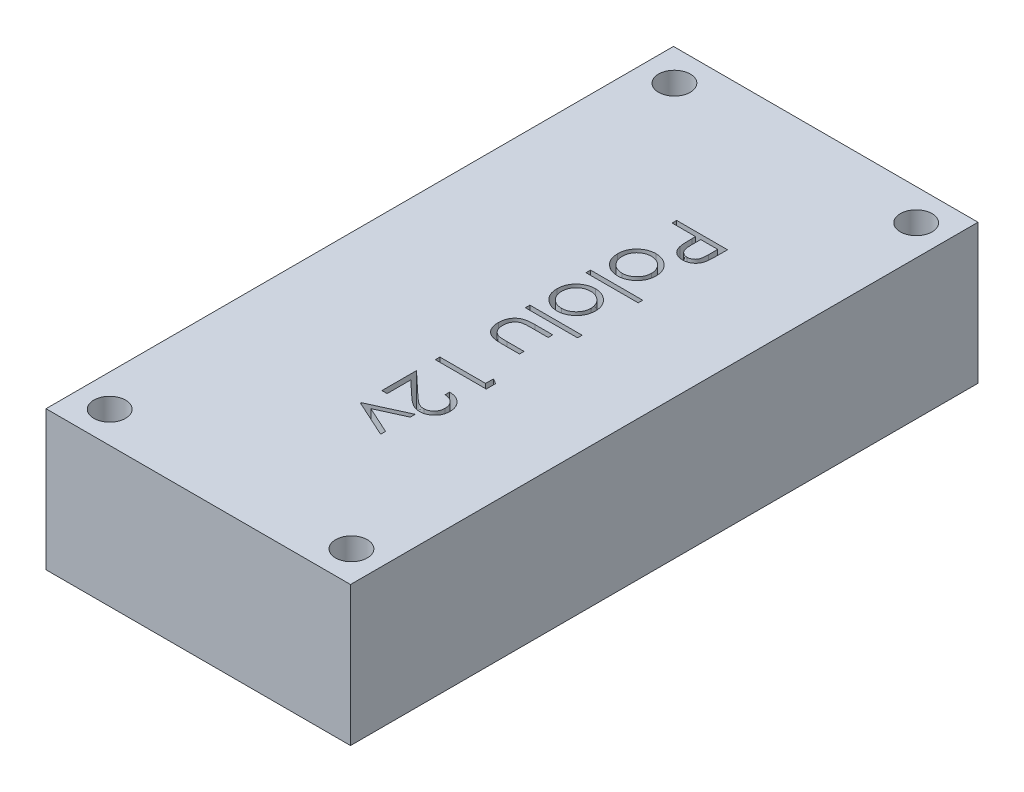
from build123d import *

# Parameters (mm, degrees)
SKETCH1_W           = 20.955
SKETCH1_H           = 43.18
BOSS_EXTRUDE1_DEPTH = 9.6
SKETCH2_R           = 1.0922
CUT_EXTRUDE1_DEPTH  = 26.846974799
SKETCH3_W           = 3.58974359
SKETCH3_H           = 0.314102564
CUT_EXTRUDE2_DEPTH  = 2.54


with BuildPart() as part:
    # Sketch1 → Boss-Extrude1 (new body)
    with BuildSketch(Plane(origin=(0, 0, 0), x_dir=(1, 0, 0), z_dir=(0, 1, 0))):
        Rectangle(SKETCH1_W, SKETCH1_H)
    extrude(amount=BOSS_EXTRUDE1_DEPTH)

    # Sketch2 → Cut-Extrude1 (cut, through all)
    with BuildSketch(Plane(origin=(0, 9.6, 0), x_dir=(1, 0, 0), z_dir=(0, 1, 0))):
        with Locations(Location((-8.255, 19.431, 0), (0, 0, 270))):
            Circle(SKETCH2_R)
        with Locations(Location((8.382, 19.431, 0), (0, 0, 270))):
            Circle(SKETCH2_R)
        with Locations(Location((8.382, -19.431, 0), (0, 0, 270))):
            Circle(SKETCH2_R)
        with Locations(Location((-8.255, -19.431, 0), (0, 0, 270))):
            Circle(SKETCH2_R)
    extrude(amount=-CUT_EXTRUDE1_DEPTH, mode=Mode.SUBTRACT)

    # Sketch3 → Cut-Extrude2 (cut)
    # profile 1 of 9: a face of its own
    with BuildSketch(Plane(origin=(0, 9.6, 0), x_dir=(1, 0, 0), z_dir=(0, 1, 0))):
        with BuildLine():
            Line((3.5, 11.330128205), (3.5, 10.643729968))
            add(Edge.make_bspline(
                [(3.5, 10.643729968), (3.499948104, 10.596519062), (3.499848668, 10.506060869), (3.496833922, 10.376345813), (3.49280723, 10.258536082), (3.487225337, 10.152885701), (3.480628747, 10.059069603), (3.471376708, 9.977512303), (3.461716412, 9.907572747), (3.451895005, 9.865666297), (3.447415865, 9.846554487)],
                knots=[0, 0, 0, 0, 1.415646017, 2.712440637, 3.8905458, 4.950247383, 5.884950622, 6.709939814, 7.411656543, 8, 8, 8, 8], degree=3))
            add(Edge.make_bspline(
                [(3.447415865, 9.846554487), (3.440793975, 9.822360896), (3.42770623, 9.774543806), (3.401491651, 9.705643589), (3.370412659, 9.640086676), (3.334976989, 9.577666458), (3.293734792, 9.519082451), (3.247990678, 9.46358474), (3.197769812, 9.410855007), (3.142098627, 9.362684464), (3.083029703, 9.318337296), (3.019247543, 9.280294152), (2.952140341, 9.248114675), (2.881020836, 9.221833844), (2.806321276, 9.201850274), (2.727823588, 9.187085782), (2.645797497, 9.177639276), (2.589736435, 9.176739893), (2.561197917, 9.176282051)],
                knots=[0, 0, 0, 0, 0.999487232, 1.975422798, 2.933948774, 3.889618007, 4.832992075, 5.786114792, 6.754729845, 7.731954186, 8.717668599, 9.695514499, 10.68728626, 11.680675814, 12.71351902, 13.766008651, 14.862761406, 16, 16, 16, 16], degree=3))
            add(Edge.make_bspline(
                [(2.561197917, 9.176282051), (2.53242014, 9.176703476), (2.476114476, 9.177528022), (2.393741688, 9.187424307), (2.315023298, 9.200754499), (2.240133847, 9.221251551), (2.169518077, 9.248097224), (2.102096845, 9.279589277), (2.039017173, 9.317572808), (1.980050055, 9.361217637), (1.925140143, 9.409769232), (1.874685348, 9.46302217), (1.82898101, 9.520761462), (1.787924666, 9.58280361), (1.752468387, 9.649753459), (1.720711082, 9.720595613), (1.694040021, 9.795945829), (1.68000996, 9.848088343), (1.672876603, 9.874599359)],
                knots=[0, 0, 0, 0, 1.121902311, 2.195077645, 3.232258892, 4.234102512, 5.217864754, 6.176164875, 7.132989551, 8.084763148, 9.034132444, 9.988522005, 10.94243251, 11.903244335, 12.886203696, 13.894208494, 14.929344452, 16, 16, 16, 16], degree=3))
            add(Edge.make_bspline(
                [(1.672876603, 9.874599359), (1.668213621, 9.896526693), (1.657994427, 9.94458172), (1.64658597, 10.023724443), (1.63684837, 10.115869828), (1.629547232, 10.220892108), (1.623296864, 10.338697013), (1.61832877, 10.469348271), (1.615598916, 10.613102348), (1.615458123, 10.713373592), (1.615384615, 10.76572516)],
                knots=[0, 0, 0, 0, 0.601384939, 1.31797006, 2.144135048, 3.087295005, 4.142315834, 5.309527816, 6.595305764, 8, 8, 8, 8], degree=3))
            Line((1.615384615, 10.76572516), (1.615384615, 11.016025641))
            Line((1.615384615, 11.016025641), (0, 11.016025641))
            Line((0, 11.016025641), (0, 11.330128205))
            Line((0, 11.330128205), (3.5, 11.330128205))
        make_face()
        with BuildLine():
            Line((3.141025641, 11.016025641), (1.974358974, 11.016025641))
            Line((1.974358974, 11.016025641), (1.966646635, 10.403245192))
            add(Edge.make_bspline(
                [(1.966646635, 10.403245192), (1.966627924, 10.373324974), (1.966591804, 10.315564609), (1.970631709, 10.231899279), (1.975087995, 10.154476281), (1.982066731, 10.083127479), (1.99126187, 10.018398126), (2.001270604, 9.959456793), (2.014830447, 9.907166353), (2.033737491, 9.845891531), (2.065355346, 9.777844435), (2.112432024, 9.704307904), (2.170792088, 9.640977962), (2.237310672, 9.586541122), (2.311578922, 9.544352716), (2.390418136, 9.512621655), (2.473877922, 9.494138495), (2.530961719, 9.491644415), (2.559795673, 9.490384615)],
                knots=[0, 0, 0, 0, 1.160368111, 2.240066715, 3.248291599, 4.168343349, 5.019594299, 5.784185847, 6.485545725, 7.113397927, 8.269509094, 9.383373363, 10.487084095, 11.595623793, 12.704274681, 13.786671823, 14.88201193, 16, 16, 16, 16], degree=3))
            add(Edge.make_bspline(
                [(2.559795673, 9.490384615), (2.587932, 9.491651143), (2.643863535, 9.494168842), (2.725874557, 9.512767449), (2.803877317, 9.544290774), (2.877231232, 9.586826997), (2.943477588, 9.639700782), (3.000520555, 9.701627273), (3.047000556, 9.771341973), (3.076793746, 9.836225159), (3.095014888, 9.89382123), (3.107758306, 9.94385443), (3.117934363, 10.000344712), (3.126173726, 10.063312612), (3.133227231, 10.132269409), (3.138013195, 10.207807735), (3.140814655, 10.289641375), (3.14095361, 10.346451946), (3.141025641, 10.375901442)],
                knots=[0, 0, 0, 0, 1.120550889, 2.227516482, 3.330715807, 4.461473166, 5.594337325, 6.694900473, 7.802844763, 8.919519911, 9.52614448, 10.208195984, 10.975273469, 11.811520316, 12.738076669, 13.736566072, 14.826679847, 16, 16, 16, 16], degree=3))
            Line((3.141025641, 10.375901442), (3.141025641, 11.016025641))
        make_face(mode=Mode.SUBTRACT)
    # profile 2 of 9: a face of its own
    with BuildSketch(Plane(origin=(0, 9.6, 0), x_dir=(1, 0, 0), z_dir=(0, 1, 0))):
        with BuildLine():
            add(Edge.make_bspline(
                [(2.602564103, 7.312700321), (2.60154521, 7.264707856), (2.599547412, 7.170606363), (2.57808998, 7.032815347), (2.545551155, 6.90142162), (2.499748526, 6.775861541), (2.439653687, 6.657173747), (2.366981145, 6.544298551), (2.281239229, 6.437462102), (2.214875573, 6.373441743), (2.181189904, 6.340945513)],
                knots=[0, 0, 0, 0, 1.054042676, 2.066720093, 3.05716247, 4.025731183, 4.997454851, 5.974904663, 6.97207755, 8, 8, 8, 8], degree=3))
            add(Edge.make_bspline(
                [(2.181189904, 6.340945513), (2.148975918, 6.312963559), (2.085171376, 6.257541179), (1.981715763, 6.18647546), (1.874575662, 6.1252539), (1.762328336, 6.076190939), (1.645953664, 6.037505915), (1.525051653, 6.010040219), (1.399889306, 5.993703284), (1.314885468, 5.991500317), (1.271834936, 5.990384615)],
                knots=[0, 0, 0, 0, 1.025258237, 2.030674902, 3.01204498, 3.988269485, 4.97094183, 5.956517959, 6.965070386, 8, 8, 8, 8], degree=3))
            add(Edge.make_bspline(
                [(1.271834936, 5.990384615), (1.228534878, 5.991365953), (1.142971945, 5.993305121), (1.01695258, 6.011648738), (0.894757754, 6.040179822), (0.776899073, 6.081011666), (0.663016196, 6.133369753), (0.553606839, 6.197260527), (0.448453965, 6.273131809), (0.348454996, 6.359137105), (0.25627808, 6.454184136), (0.175988565, 6.557317833), (0.106912047, 6.666586212), (0.052046085, 6.783480894), (0.007820299, 6.90633792), (-0.022676228, 7.035938738), (-0.041279936, 7.172167733), (-0.043657667, 7.265197189), (-0.044871795, 7.312700321)],
                knots=[0, 0, 0, 0, 0.998669827, 1.973418153, 2.932281609, 3.89081133, 4.846438734, 5.82045571, 6.809776312, 7.834649874, 8.860672198, 9.859676908, 10.845817165, 11.837296335, 12.833502054, 13.853824644, 14.904110009, 16, 16, 16, 16], degree=3))
            add(Edge.make_bspline(
                [(-0.044871795, 7.312700321), (-0.043647621, 7.360433905), (-0.041250016, 7.45392254), (-0.022814613, 7.590664495), (0.008146141, 7.720810973), (0.05149858, 7.844249141), (0.107362699, 7.961143349), (0.175719795, 8.070815203), (0.256318736, 8.173997547), (0.34844398, 8.269074376), (0.448456803, 8.355071682), (0.553606102, 8.430945026), (0.663016387, 8.494835265), (0.776899022, 8.547193491), (0.894757767, 8.588025298), (1.016952576, 8.616556393), (1.142971946, 8.634900007), (1.228534878, 8.636839175), (1.271834936, 8.637820513)],
                knots=[0, 0, 0, 0, 1.099861214, 2.154133753, 3.1731438, 4.178222029, 5.163564916, 6.153006591, 7.15072618, 8.175428628, 9.198983792, 10.187031731, 11.15979573, 12.114193814, 13.071490482, 14.029120454, 15.002614863, 16, 16, 16, 16], degree=3))
            add(Edge.make_bspline(
                [(1.271834936, 8.637820513), (1.314651482, 8.636697202), (1.399420884, 8.634473241), (1.524347945, 8.618152732), (1.645045334, 8.590794175), (1.76097081, 8.552062779), (1.872726246, 8.502547588), (1.980131077, 8.4421863), (2.083118877, 8.370395668), (2.146840957, 8.315193716), (2.179086538, 8.287259615)],
                knots=[0, 0, 0, 0, 1.031353054, 2.041901799, 3.029428768, 4.008703097, 4.981709435, 5.96992636, 6.972712378, 8, 8, 8, 8], degree=3))
            add(Edge.make_bspline(
                [(2.179086538, 8.287259615), (2.213058664, 8.254809688), (2.279870826, 8.190991195), (2.365443569, 8.083661574), (2.439095912, 7.971271927), (2.499160507, 7.851818556), (2.54546805, 7.725909349), (2.578241849, 7.593539077), (2.5994525, 7.45524653), (2.601516565, 7.360689257), (2.602564103, 7.312700321)],
                knots=[0, 0, 0, 0, 1.027951202, 2.021646915, 2.998468564, 3.9668038, 4.943370589, 5.93035926, 6.949632805, 8, 8, 8, 8], degree=3))
        make_face()
        with BuildLine():
            add(Edge.make_bspline(
                [(2.288461538, 7.314102564), (2.287496895, 7.348040137), (2.285592509, 7.415039191), (2.271109357, 7.513659325), (2.24815907, 7.608597446), (2.215565273, 7.700045787), (2.173427645, 7.787650658), (2.121963898, 7.871508449), (2.060899931, 7.951393865), (1.991449449, 8.026693213), (1.916014047, 8.096610612), (1.834897943, 8.157024748), (1.750428202, 8.208490862), (1.662166361, 8.251320233), (1.56927654, 8.283230327), (1.472795205, 8.306402561), (1.372529979, 8.320873014), (1.304368935, 8.322759364), (1.269731571, 8.323717949)],
                knots=[0, 0, 0, 0, 1.021589593, 2.016807015, 2.994807536, 3.958602519, 4.934347097, 5.916793557, 6.916107818, 7.957073844, 8.998039869, 10.008589932, 10.997041759, 11.972786337, 12.956492182, 13.948170289, 14.957322718, 16, 16, 16, 16], degree=3))
            add(Edge.make_bspline(
                [(1.269731571, 8.323717949), (1.224977566, 8.322115365), (1.136149235, 8.318934536), (1.005367193, 8.292936951), (0.879576721, 8.249753749), (0.760292369, 8.190207006), (0.64973484, 8.116873401), (0.550320988, 8.03112479), (0.465884611, 7.931775669), (0.394872197, 7.822209065), (0.338949987, 7.703977678), (0.298846326, 7.579063706), (0.273127506, 7.448604529), (0.270541049, 7.359328933), (0.269230769, 7.314102564)],
                knots=[0, 0, 0, 0, 1.016977094, 2.018509362, 3.018404954, 4.033172147, 5.041280572, 6.028085189, 7.007940189, 7.995502847, 8.989109012, 9.972200833, 10.97273166, 12, 12, 12, 12], degree=3))
            add(Edge.make_bspline(
                [(0.269230769, 7.314102564), (0.270533459, 7.268873594), (0.273104934, 7.179592863), (0.298976626, 7.048952169), (0.338775602, 6.923695847), (0.394935358, 6.80534153), (0.465616203, 6.695725029), (0.550802015, 6.597085329), (0.649473499, 6.510598262), (0.760145777, 6.437192044), (0.879762163, 6.378604764), (1.005344015, 6.335218484), (1.136155138, 6.309283248), (1.224979543, 6.306094003), (1.269731571, 6.304487179)],
                knots=[0, 0, 0, 0, 1.027082318, 2.027431966, 3.015401697, 4.008827937, 4.996211763, 5.971861488, 6.96198607, 7.969911943, 8.982141629, 9.981856156, 10.983207064, 12, 12, 12, 12], degree=3))
            add(Edge.make_bspline(
                [(1.269731571, 6.304487179), (1.3043717, 6.305438632), (1.372538187, 6.307310946), (1.472763828, 6.321883487), (1.569467367, 6.344695763), (1.661792021, 6.378003207), (1.750859277, 6.419362649), (1.834644294, 6.472080737), (1.916065613, 6.532213476), (1.991403982, 6.602259171), (2.061153687, 6.677550042), (2.121741455, 6.758035601), (2.173457034, 6.841932338), (2.215570463, 6.929564895), (2.248033616, 7.020806293), (2.271209332, 7.115456176), (2.285539702, 7.213639574), (2.287481364, 7.280400719), (2.288461538, 7.314102564)],
                knots=[0, 0, 0, 0, 1.043020522, 2.052505155, 3.044509714, 4.030878336, 5.003918577, 5.996372628, 7.007255355, 8.048564058, 9.08987276, 10.095126797, 11.077896669, 12.053962454, 13.01807471, 13.98956039, 14.985105429, 16, 16, 16, 16], degree=3))
        make_face(mode=Mode.SUBTRACT)
    # profile 3 of 9: a face of its own
    with BuildSketch(Plane(origin=(0, 9.6, 0), x_dir=(1, 0, 0), z_dir=(0, 1, 0))):
        with Locations((1.794871795, 5.25)):
            Rectangle(SKETCH3_W, SKETCH3_H)
    # profile 4 of 9: a face of its own
    with BuildSketch(Plane(origin=(0, 9.6, 0), x_dir=(1, 0, 0), z_dir=(0, 1, 0))):
        with BuildLine():
            add(Edge.make_bspline(
                [(2.602564103, 3.139623397), (2.60154521, 3.091630933), (2.599547412, 2.99752944), (2.57808998, 2.859738424), (2.545551155, 2.728344697), (2.499748526, 2.602784618), (2.439653687, 2.484096824), (2.366981145, 2.371221628), (2.281239229, 2.264385179), (2.214875573, 2.20036482), (2.181189904, 2.16786859)],
                knots=[0, 0, 0, 0, 1.054042676, 2.066720093, 3.05716247, 4.025731183, 4.997454851, 5.974904663, 6.97207755, 8, 8, 8, 8], degree=3))
            add(Edge.make_bspline(
                [(2.181189904, 2.16786859), (2.148975918, 2.139886636), (2.085171376, 2.084464255), (1.981715763, 2.013398537), (1.874575662, 1.952176976), (1.762328336, 1.903114016), (1.645953664, 1.864428992), (1.525051653, 1.836963296), (1.399889306, 1.820626361), (1.314885468, 1.818423394), (1.271834936, 1.817307692)],
                knots=[0, 0, 0, 0, 1.025258237, 2.030674902, 3.01204498, 3.988269485, 4.97094183, 5.956517959, 6.965070386, 8, 8, 8, 8], degree=3))
            add(Edge.make_bspline(
                [(1.271834936, 1.817307692), (1.228534878, 1.81828903), (1.142971945, 1.820228198), (1.01695258, 1.838571815), (0.894757754, 1.867102899), (0.776899073, 1.907934743), (0.663016196, 1.96029283), (0.553606839, 2.024183604), (0.448453965, 2.100054886), (0.348454996, 2.186060182), (0.25627808, 2.281107212), (0.175988565, 2.38424091), (0.106912047, 2.493509289), (0.052046085, 2.610403971), (0.007820299, 2.733260997), (-0.022676228, 2.862861815), (-0.041279936, 2.99909081), (-0.043657667, 3.092120266), (-0.044871795, 3.139623397)],
                knots=[0, 0, 0, 0, 0.998669827, 1.973418153, 2.932281609, 3.89081133, 4.846438734, 5.82045571, 6.809776312, 7.834649874, 8.860672198, 9.859676908, 10.845817165, 11.837296335, 12.833502054, 13.853824644, 14.904110009, 16, 16, 16, 16], degree=3))
            add(Edge.make_bspline(
                [(-0.044871795, 3.139623397), (-0.043647621, 3.187356981), (-0.041250016, 3.280845617), (-0.022814613, 3.417587572), (0.008146141, 3.54773405), (0.05149858, 3.671172218), (0.107362699, 3.788066426), (0.175719795, 3.89773828), (0.256318736, 4.000920624), (0.34844398, 4.095997453), (0.448456803, 4.181994759), (0.553606102, 4.257868103), (0.663016387, 4.321758342), (0.776899022, 4.374116568), (0.894757767, 4.414948375), (1.016952576, 4.44347947), (1.142971946, 4.461823084), (1.228534878, 4.463762252), (1.271834936, 4.46474359)],
                knots=[0, 0, 0, 0, 1.099861214, 2.154133753, 3.1731438, 4.178222029, 5.163564916, 6.153006591, 7.15072618, 8.175428628, 9.198983792, 10.187031731, 11.15979573, 12.114193814, 13.071490482, 14.029120454, 15.002614863, 16, 16, 16, 16], degree=3))
            add(Edge.make_bspline(
                [(1.271834936, 4.46474359), (1.314651482, 4.463620279), (1.399420884, 4.461396318), (1.524347945, 4.445075809), (1.645045334, 4.417717252), (1.76097081, 4.378985856), (1.872726246, 4.329470665), (1.980131077, 4.269109377), (2.083118877, 4.197318745), (2.146840957, 4.142116793), (2.179086538, 4.114182692)],
                knots=[0, 0, 0, 0, 1.031353054, 2.041901799, 3.029428768, 4.008703097, 4.981709435, 5.96992636, 6.972712378, 8, 8, 8, 8], degree=3))
            add(Edge.make_bspline(
                [(2.179086538, 4.114182692), (2.213058664, 4.081732764), (2.279870826, 4.017914272), (2.365443569, 3.910584651), (2.439095912, 3.798195004), (2.499160507, 3.678741633), (2.54546805, 3.552832426), (2.578241849, 3.420462154), (2.5994525, 3.282169607), (2.601516565, 3.187612334), (2.602564103, 3.139623397)],
                knots=[0, 0, 0, 0, 1.027951202, 2.021646915, 2.998468564, 3.9668038, 4.943370589, 5.93035926, 6.949632805, 8, 8, 8, 8], degree=3))
        make_face()
        with BuildLine():
            add(Edge.make_bspline(
                [(2.288461538, 3.141025641), (2.287496895, 3.174963214), (2.285592509, 3.241962268), (2.271109357, 3.340582402), (2.24815907, 3.435520523), (2.215565273, 3.526968864), (2.173427645, 3.614573735), (2.121963898, 3.698431526), (2.060899931, 3.778316942), (1.991449449, 3.85361629), (1.916014047, 3.923533689), (1.834897943, 3.983947825), (1.750428202, 4.035413939), (1.662166361, 4.07824331), (1.56927654, 4.110153403), (1.472795205, 4.133325638), (1.372529979, 4.147796091), (1.304368935, 4.14968244), (1.269731571, 4.150641026)],
                knots=[0, 0, 0, 0, 1.021589593, 2.016807015, 2.994807536, 3.958602519, 4.934347097, 5.916793557, 6.916107818, 7.957073844, 8.998039869, 10.008589932, 10.997041759, 11.972786337, 12.956492182, 13.948170289, 14.957322718, 16, 16, 16, 16], degree=3))
            add(Edge.make_bspline(
                [(1.269731571, 4.150641026), (1.224977566, 4.149038442), (1.136149235, 4.145857613), (1.005367193, 4.119860027), (0.879576721, 4.076676826), (0.760292369, 4.017130083), (0.64973484, 3.943796478), (0.550320988, 3.858047867), (0.465884611, 3.758698746), (0.394872197, 3.649132142), (0.338949987, 3.530900755), (0.298846326, 3.405986783), (0.273127506, 3.275527606), (0.270541049, 3.18625201), (0.269230769, 3.141025641)],
                knots=[0, 0, 0, 0, 1.016977094, 2.018509362, 3.018404954, 4.033172147, 5.041280572, 6.028085189, 7.007940189, 7.995502847, 8.989109012, 9.972200833, 10.97273166, 12, 12, 12, 12], degree=3))
            add(Edge.make_bspline(
                [(0.269230769, 3.141025641), (0.270533459, 3.095796671), (0.273104934, 3.00651594), (0.298976626, 2.875875245), (0.338775602, 2.750618924), (0.394935358, 2.632264606), (0.465616203, 2.522648106), (0.550802015, 2.424008406), (0.649473499, 2.337521339), (0.760145777, 2.264115121), (0.879762163, 2.205527841), (1.005344015, 2.162141561), (1.136155138, 2.136206324), (1.224979543, 2.13301708), (1.269731571, 2.131410256)],
                knots=[0, 0, 0, 0, 1.027082318, 2.027431966, 3.015401697, 4.008827937, 4.996211763, 5.971861488, 6.96198607, 7.969911943, 8.982141629, 9.981856156, 10.983207064, 12, 12, 12, 12], degree=3))
            add(Edge.make_bspline(
                [(1.269731571, 2.131410256), (1.3043717, 2.132361709), (1.372538187, 2.134234023), (1.472763828, 2.148806564), (1.569467367, 2.171618839), (1.661792021, 2.204926284), (1.750859277, 2.246285726), (1.834644294, 2.299003813), (1.916065613, 2.359136553), (1.991403982, 2.429182248), (2.061153687, 2.504473119), (2.121741455, 2.584958678), (2.173457034, 2.668855415), (2.215570463, 2.756487972), (2.248033616, 2.84772937), (2.271209332, 2.942379253), (2.285539702, 3.040562651), (2.287481364, 3.107323796), (2.288461538, 3.141025641)],
                knots=[0, 0, 0, 0, 1.043020522, 2.052505155, 3.044509714, 4.030878336, 5.003918577, 5.996372628, 7.007255355, 8.048564058, 9.08987276, 10.095126797, 11.077896669, 12.053962454, 13.01807471, 13.98956039, 14.985105429, 16, 16, 16, 16], degree=3))
        make_face(mode=Mode.SUBTRACT)
    # profile 5 of 9: a face of its own
    with BuildSketch(Plane(origin=(0, 9.6, 0), x_dir=(1, 0, 0), z_dir=(0, 1, 0))):
        with Locations((1.794871795, 1.076923077)):
            Rectangle(SKETCH3_W, SKETCH3_H)
    # profile 6 of 9: a face of its own
    with BuildSketch(Plane(origin=(0, 9.6, 0), x_dir=(1, 0, 0), z_dir=(0, 1, 0))):
        with BuildLine():
            Line((2.557692308, 0.246794872), (2.557692308, -0.067307692))
            Line((2.557692308, -0.067307692), (1.371394231, -0.067307692))
            add(Edge.make_bspline(
                [(1.371394231, -0.067307692), (1.336571482, -0.067449597), (1.269957194, -0.067721055), (1.174102007, -0.069561996), (1.086685294, -0.073892089), (1.007656557, -0.079305914), (0.937029166, -0.08626805), (0.875049809, -0.09455141), (0.821015625, -0.103809832), (0.788472269, -0.112872546), (0.77333734, -0.11708734)],
                knots=[0, 0, 0, 0, 1.388932606, 2.656963016, 3.823490214, 4.879454478, 5.816252168, 6.653371382, 7.373723809, 8, 8, 8, 8], degree=3))
            add(Edge.make_bspline(
                [(0.77333734, -0.11708734), (0.754314522, -0.123848839), (0.716664366, -0.137231268), (0.66227459, -0.161504107), (0.611902173, -0.191534842), (0.563587464, -0.224385766), (0.518825676, -0.262318827), (0.477324454, -0.304779376), (0.438599671, -0.351013747), (0.391894487, -0.418737947), (0.342467449, -0.511317768), (0.299224971, -0.632594425), (0.273761575, -0.764331943), (0.270768951, -0.855489547), (0.269230769, -0.90234375)],
                knots=[0, 0, 0, 0, 0.725930277, 1.436768641, 2.137297926, 2.832005607, 3.535753883, 4.242956221, 4.964984144, 5.701683124, 7.198126434, 8.723945959, 10.316137162, 12, 12, 12, 12], degree=3))
            add(Edge.make_bspline(
                [(0.269230769, -0.90234375), (0.270763206, -0.949203891), (0.273720675, -1.039639854), (0.298840522, -1.170000907), (0.339821483, -1.289386025), (0.397828501, -1.39640128), (0.468546589, -1.490374872), (0.551561506, -1.568677316), (0.644209328, -1.633285076), (0.713333816, -1.661494429), (0.748096955, -1.67568109)],
                knots=[0, 0, 0, 0, 1.157091467, 2.233085092, 3.266839029, 4.264239195, 5.228693433, 6.160074799, 7.074690074, 8, 8, 8, 8], degree=3))
            add(Edge.make_bspline(
                [(0.748096955, -1.67568109), (0.762062957, -1.679878422), (0.792938376, -1.6891577), (0.84532423, -1.699056217), (0.907735501, -1.708342029), (0.980827619, -1.714532787), (1.06395603, -1.721598345), (1.157550626, -1.724038101), (1.261059725, -1.727522198), (1.333529294, -1.727549722), (1.371394231, -1.727564103)],
                knots=[0, 0, 0, 0, 0.557560243, 1.232629526, 2.036798082, 2.970922211, 4.03790722, 5.227863888, 6.551574656, 8, 8, 8, 8], degree=3))
            Line((1.371394231, -1.727564103), (2.557692308, -1.727564103))
            Line((2.557692308, -1.727564103), (2.557692308, -2.041666667))
            Line((2.557692308, -2.041666667), (1.3125, -2.041666667))
            add(Edge.make_bspline(
                [(1.3125, -2.041666667), (1.270192828, -2.041224973), (1.188111126, -2.040368027), (1.068827026, -2.034860669), (0.957664743, -2.025411106), (0.854565649, -2.011068253), (0.759607746, -1.994203142), (0.672671696, -1.972445003), (0.594017487, -1.946472989), (0.522291359, -1.917146552), (0.457190155, -1.882597295), (0.395768795, -1.845578014), (0.338129531, -1.804031489), (0.283989051, -1.758325679), (0.233543731, -1.708665864), (0.187013486, -1.65472027), (0.143574873, -1.597570957), (0.104077801, -1.536221623), (0.068870026, -1.470609615), (0.038173414, -1.401065049), (0.012814759, -1.327080619), (-0.007920575, -1.249485111), (-0.025090313, -1.167629183), (-0.036599343, -1.081865785), (-0.043925522, -0.991982608), (-0.044551074, -0.930871141), (-0.044871795, -0.899539263)],
                knots=[0, 0, 0, 0, 1.492959813, 2.896546261, 4.212934643, 5.4282803, 6.568701279, 7.614836728, 8.587629399, 9.489753423, 10.345563548, 11.185732697, 12.018869657, 12.849922188, 13.68387515, 14.5140269, 15.361852057, 16.215154979, 17.085973896, 17.987004002, 18.894652782, 19.842944701, 20.819888734, 21.843945232, 22.894589698, 24, 24, 24, 24], degree=3))
            add(Edge.make_bspline(
                [(-0.044871795, -0.899539263), (-0.044532088, -0.868442749), (-0.043864532, -0.807335204), (-0.036722724, -0.717663959), (-0.024914553, -0.631715353), (-0.008059336, -0.549794955), (0.012979734, -0.471820557), (0.03798327, -0.397476317), (0.069063751, -0.327632754), (0.104041309, -0.26145075), (0.143606584, -0.199448362), (0.186974624, -0.141339784), (0.234080687, -0.087202932), (0.284728044, -0.037025864), (0.33954498, 0.008487113), (0.398090541, 0.049903155), (0.459784629, 0.08785986), (0.525847792, 0.12221265), (0.598419802, 0.151724406), (0.678716899, 0.177779652), (0.767619415, 0.19909029), (0.865051344, 0.216432758), (0.970546385, 0.230384199), (1.084714801, 0.240070341), (1.207278493, 0.245486172), (1.291928383, 0.246349233), (1.335637019, 0.246794872)],
                knots=[0, 0, 0, 0, 1.083640291, 2.129454052, 3.13281866, 4.105697902, 5.042300162, 5.946461698, 6.836384745, 7.703652036, 8.553297018, 9.397182691, 10.228592656, 11.052265423, 11.879314572, 12.708807002, 13.549817954, 14.402308542, 15.300838682, 16.27712199, 17.341985831, 18.484375296, 19.725102775, 21.0496083, 22.476576903, 24, 24, 24, 24], degree=3))
            Line((1.335637019, 0.246794872), (2.557692308, 0.246794872))
        make_face()
    # profile 7 of 9: a face of its own
    with BuildSketch(Plane(origin=(0, 9.6, 0), x_dir=(1, 0, 0), z_dir=(0, 1, 0))):
        Polygon((3.5, -4.625300481), (3.5, -5.272435897), (0, -5.272435897), (0, -4.958333333), (3.141025641, -4.958333333), (3.141025641, -4.419871795), align=None)
    # profile 8 of 9: a face of its own
    with BuildSketch(Plane(origin=(0, 9.6, 0), x_dir=(1, 0, 0), z_dir=(0, 1, 0))):
        with BuildLine():
            Line((2.423076923, -7.022435897), (2.423076923, -6.708333333))
            add(Edge.make_bspline(
                [(2.423076923, -6.708333333), (2.464748016, -6.710380138), (2.546588934, -6.714400008), (2.665909934, -6.733233227), (2.779975252, -6.76015626), (2.887806988, -6.798312478), (2.990693283, -6.845432072), (3.087267925, -6.903120092), (3.178489406, -6.970146722), (3.262630601, -7.046388998), (3.339546174, -7.129118895), (3.406669589, -7.217840731), (3.46273344, -7.311642615), (3.5098564, -7.409710947), (3.545184955, -7.513179919), (3.571409677, -7.621060481), (3.587185182, -7.733840244), (3.588881084, -7.810680179), (3.58974359, -7.849759615)],
                knots=[0, 0, 0, 0, 1.100776268, 2.161895295, 3.184016182, 4.190939212, 5.176500551, 6.166955529, 7.155448256, 8.160289653, 9.16017456, 10.133824356, 11.091467644, 12.04088621, 13.000931625, 13.972173743, 14.968683325, 16, 16, 16, 16], degree=3))
            add(Edge.make_bspline(
                [(3.58974359, -7.849759615), (3.588845133, -7.888137689), (3.587079698, -7.963549234), (3.571918669, -8.073611249), (3.548173078, -8.178388543), (3.514857661, -8.27767631), (3.470073234, -8.370682374), (3.416275695, -8.458105419), (3.354055864, -8.540986229), (3.28080205, -8.615593013), (3.202599666, -8.684101092), (3.119111762, -8.743203347), (3.032882477, -8.793816511), (2.943254275, -8.836004191), (2.849383247, -8.86706033), (2.752636044, -8.890638538), (2.652011233, -8.903965951), (2.583904677, -8.906011375), (2.549278846, -8.907051282)],
                knots=[0, 0, 0, 0, 1.111607364, 2.184268762, 3.212621178, 4.221274766, 5.211760367, 6.196651075, 7.1921475, 8.207485113, 9.220403448, 10.201281604, 11.166441695, 12.114753415, 13.065576456, 14.026450734, 14.996634279, 16, 16, 16, 16], degree=3))
            add(Edge.make_bspline(
                [(2.549278846, -8.907051282), (2.500531012, -8.905358019), (2.403890798, -8.902001208), (2.261875935, -8.873286831), (2.124282516, -8.82844032), (2.013545214, -8.774442963), (1.92431172, -8.719970519), (1.850843015, -8.670883012), (1.771737547, -8.613418201), (1.68726021, -8.546739703), (1.596749304, -8.472226831), (1.500259509, -8.389204667), (1.398787739, -8.297081185), (1.329482138, -8.232422684), (1.293569712, -8.198918269)],
                knots=[0, 0, 0, 0, 1.184426356, 2.348067706, 3.509069118, 4.696110526, 5.333549288, 6.050745305, 6.844228056, 7.710549037, 8.667450064, 9.695053472, 10.805634456, 12, 12, 12, 12], degree=3))
            Line((1.293569712, -8.198918269), (0.358974359, -7.323217147))
            Line((0.358974359, -7.323217147), (0.358974359, -8.951923077))
            Line((0.358974359, -8.951923077), (0, -8.951923077))
            Line((0, -8.951923077), (0, -6.573717949))
            Line((0, -6.573717949), (1.448517628, -7.931089744))
            add(Edge.make_bspline(
                [(1.448517628, -7.931089744), (1.483014053, -7.96413997), (1.549274626, -8.027622691), (1.646042341, -8.117374485), (1.735709677, -8.198115695), (1.818673971, -8.269899879), (1.894464892, -8.332786103), (1.963676397, -8.386573158), (2.025714532, -8.431498774), (2.098594339, -8.479110564), (2.187681869, -8.524511566), (2.296003864, -8.564414401), (2.407759457, -8.588571034), (2.483257707, -8.591483648), (2.521233974, -8.592948718)],
                knots=[0, 0, 0, 0, 1.329530082, 2.553755191, 3.672934919, 4.687409497, 5.60679272, 6.413407421, 7.126401618, 7.737995624, 8.834647426, 9.90044882, 10.943907757, 12, 12, 12, 12], degree=3))
            add(Edge.make_bspline(
                [(2.521233974, -8.592948718), (2.545118012, -8.592319506), (2.592188863, -8.59107945), (2.661156757, -8.579928054), (2.727942288, -8.56354444), (2.7917197, -8.53829223), (2.853743372, -8.507952629), (2.91212759, -8.469191552), (2.968862533, -8.424897819), (3.022002807, -8.373519262), (3.07068755, -8.317115152), (3.113810711, -8.257518967), (3.149850063, -8.194469368), (3.179393496, -8.12822911), (3.202568894, -8.058983678), (3.218627469, -7.986598923), (3.228709954, -7.911274909), (3.230074126, -7.859841413), (3.230769231, -7.833633814)],
                knots=[0, 0, 0, 0, 0.991504627, 1.954065223, 2.895985987, 3.842598665, 4.797835564, 5.759220273, 6.74786863, 7.784730864, 8.824135544, 9.839918996, 10.835834653, 11.835434876, 12.84861661, 13.863796685, 14.911511676, 16, 16, 16, 16], degree=3))
            add(Edge.make_bspline(
                [(3.230769231, -7.833633814), (3.230054415, -7.80626286), (3.228650634, -7.752510825), (3.218824902, -7.673593516), (3.201890229, -7.598301465), (3.178673151, -7.526482259), (3.149442666, -7.458066702), (3.112332364, -7.393673407), (3.068791169, -7.332714485), (3.019156583, -7.275301894), (2.963634417, -7.222548731), (2.902503649, -7.175224858), (2.835366634, -7.134862596), (2.763739792, -7.099083268), (2.685718657, -7.071706787), (2.603193858, -7.048305634), (2.514992916, -7.031306427), (2.454224465, -7.025441851), (2.423076923, -7.022435897)],
                knots=[0, 0, 0, 0, 1.031212865, 2.025131798, 2.990757446, 3.934781266, 4.865570067, 5.788494791, 6.729227313, 7.684356718, 8.643577152, 9.610526866, 10.590658432, 11.59095419, 12.621640561, 13.700587263, 14.82141059, 16, 16, 16, 16], degree=3))
        make_face()
    # profile 9 of 9: a face of its own
    with BuildSketch(Plane(origin=(0, 9.6, 0), x_dir=(1, 0, 0), z_dir=(0, 1, 0))):
        Polygon((2.557692308, -9.221153846), (2.557692308, -9.561197917), (0.695512821, -10.41025641), (2.557692308, -11.259314904), (2.557692308, -11.599358974), (0, -10.432692308), (0, -10.387820513), align=None)
    extrude(amount=-CUT_EXTRUDE2_DEPTH, mode=Mode.SUBTRACT)


solid = part.part
